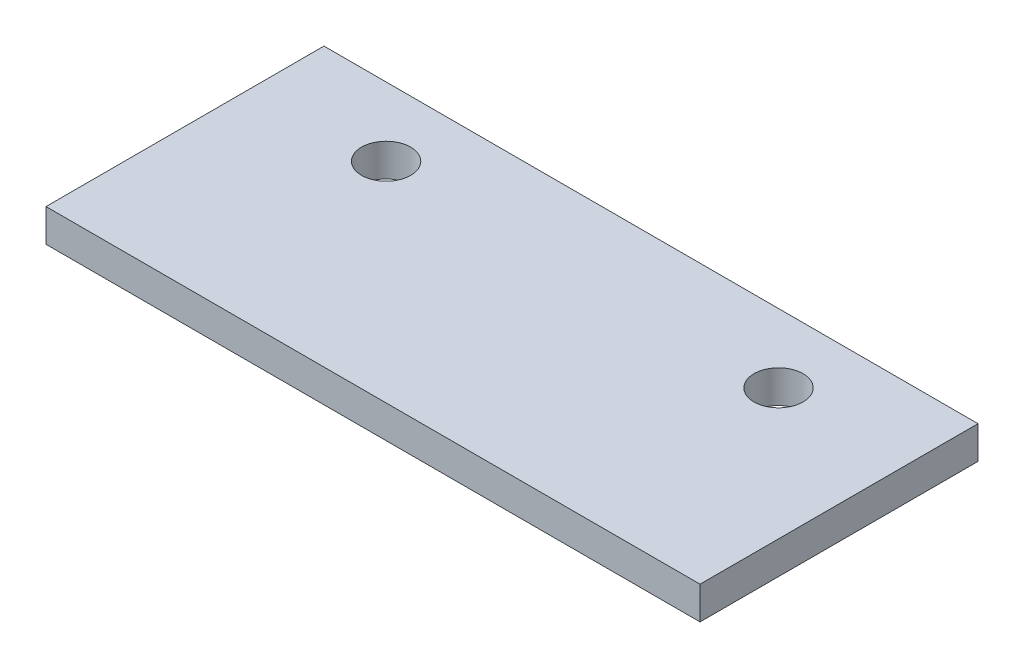
from build123d import *

# Parameters (mm, degrees)
SKETCH1_W           = 200
SKETCH1_H           = 85
BOSS_EXTRUDE1_DEPTH = 10
SKETCH2_R           = 7.5
CUT_EXTRUDE1_DEPTH  = 10


with BuildPart() as part:
    # Sketch1 → Boss-Extrude1 (new body)
    with BuildSketch(Plane(origin=(0, 0, 0), x_dir=(1, 0, 0), z_dir=(0, 1, 0))):
        Rectangle(SKETCH1_W, SKETCH1_H)
    extrude(amount=BOSS_EXTRUDE1_DEPTH)

    # Sketch2 → Cut-Extrude1 (cut)
    with BuildSketch(Plane(origin=(0, 10, 0), x_dir=(1, 0, 0), z_dir=(0, 1, 0))):
        with Locations(Location((-60, 21.5, 0), (0, 0, 270))):
            Circle(SKETCH2_R)
    cut_extrude1 = extrude(amount=-CUT_EXTRUDE1_DEPTH, mode=Mode.SUBTRACT)

    # Mirror1: Cut-Extrude1 across plane
    add(cut_extrude1.mirror(Plane(origin=(0, 0, 0), x_dir=(0, 0, 1), z_dir=(1, 0, 0))), mode=Mode.SUBTRACT)


solid = part.part
